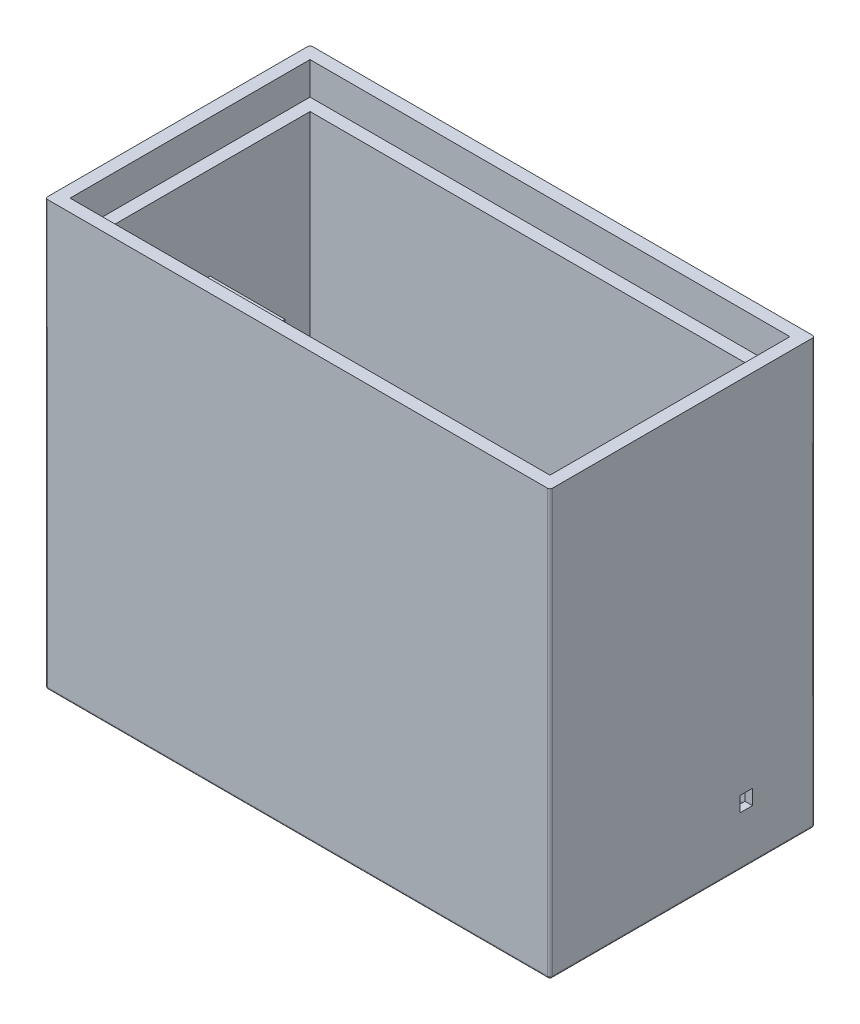
from build123d import *

# Parameters (mm, degrees)
SKETCH1_2_W             = 20.2
SKETCH1_2_H             = 10.6
SKETCH1_2_W_2           = 18.2
SKETCH1_2_H_2           = 8.6
BOSS_EXTRUDE1_DEPTH     = 17
SKETCH3_W               = 8.6
SKETCH3_H               = 1
BOSS_EXTRUDE2_DEPTH     = 19.2
SKETCH4_W               = 19.2
SKETCH4_H               = 9.6
CUT_EXTRUDE1_DEPTH      = 1.3
CUT_EXTRUDE2_REACH      = 22.472
SKETCH6_R               = 1.5
SKETCH8_W               = 0.4
SKETCH8_H               = 11
BOSS_EXTRUDE3_DEPTH     = 3
CUT_EXTRUDE3_DEPTH      = 27.186446876
CUT_EXTRUDE3_DEPTH_BACK = 27.186446876
SKETCH11_W              = 0.5
SKETCH11_H              = 0.6
FILLET12_R              = 0.1
FILLET13_R              = 0.1
SKETCH13_W              = 1.7
SKETCH13_H              = 1.6
CUT_EXTRUDE4_DEPTH      = 0.7


with BuildPart() as part:
    # Sketch1<2> → Boss-Extrude1 (new body)
    with BuildSketch(Plane(origin=(0, 0, 0), x_dir=(1, 0, 0), z_dir=(0, 1, 0))):
        Rectangle(SKETCH1_2_W, SKETCH1_2_H)
        Rectangle(SKETCH1_2_W_2, SKETCH1_2_H_2, mode=Mode.SUBTRACT)
    extrude(amount=BOSS_EXTRUDE1_DEPTH)

    # Sketch3 → Boss-Extrude2 (add)
    with BuildSketch(Plane(origin=(-9.1, 0, 0), x_dir=(0, 0, -1), z_dir=(1, 0, 0))):
        with Locations((0, 0.5)):
            Rectangle(SKETCH3_W, SKETCH3_H)
    extrude(amount=BOSS_EXTRUDE2_DEPTH)

    # Sketch4 → Cut-Extrude1 (cut)
    with BuildSketch(Plane(origin=(0, 17, 0), x_dir=(1, 0, 0), z_dir=(0, 1, 0))):
        Rectangle(SKETCH4_W, SKETCH4_H)
    extrude(amount=-CUT_EXTRUDE1_DEPTH, mode=Mode.SUBTRACT)

    # Sketch6 → Cut-Extrude2 (cut, up to next)
    with BuildSketch(Plane.XZ, mode=Mode.PRIVATE) as cut_extrude2_sk1:
        with Locations(Location((0, 2, 0), (0, 0, 270))):
            Circle(SKETCH6_R)
    cut_extrude2_tool1 = extrude(cut_extrude2_sk1.sketch, amount=-CUT_EXTRUDE2_REACH, mode=Mode.PRIVATE) & part.part
    add(cut_extrude2_tool1.solids().sort_by_distance((0, 0, 2))[0], mode=Mode.SUBTRACT)

    # Sketch8 → Boss-Extrude3 (add)
    with BuildSketch(Plane(origin=(-9.1, 0, 0), x_dir=(0, 0, -1), z_dir=(1, 0, 0))):
        with Locations((0.1, 6.5)):
            Rectangle(SKETCH8_W, SKETCH8_H)
    boss_extrude3 = extrude(amount=BOSS_EXTRUDE3_DEPTH)

    # Mirror1: Boss-Extrude3 across plane
    add(boss_extrude3.mirror(Plane(origin=(0, 0, 0), x_dir=(0, 0, 1), z_dir=(1, 0, 0))))

    # Sketch11 → Cut-Extrude3 (cut, two sides: drawn at the far end of the back side and taken through both)
    with BuildSketch(Plane(origin=(-9.1, 0, 0), x_dir=(0, 0, -1), z_dir=(1, 0, 0)).offset(-CUT_EXTRUDE3_DEPTH_BACK)):
        with Locations((2.55, 2.3)):
            Rectangle(SKETCH11_W, SKETCH11_H)
    extrude(amount=CUT_EXTRUDE3_DEPTH + CUT_EXTRUDE3_DEPTH_BACK, mode=Mode.SUBTRACT)

    # Fillet12
    fillet12_edges = [part.edges().sort_by_distance(p)[0] for p in [
        (10.1, 8.5, 5.3),
        (-10.1, 8.5, 5.3),
        (-10.1, 8.5, -5.3),
        (10.1, 8.5, -5.3),
    ]]
    fillet(fillet12_edges, radius=FILLET12_R)

    # Fillet13
    fillet13_edges = [part.edges().sort_by_distance(p)[0] for p in [
        (0, 0, 5.3),
        (0, 0, -5.3),
        (10.1, 0, 0),
        (-10.1, 0, 0),
        (-10.070710678, 0, -5.270710678),
        (10.070710678, 0, -5.270710678),
        (10.070710678, 0, 5.270710678),
        (-10.070710678, 0, 5.270710678),
    ]]
    fillet(fillet13_edges, radius=FILLET13_R)

    # Sketch13 → Cut-Extrude4 (cut)
    with BuildSketch(Plane(origin=(-9.1, 0, 0), x_dir=(0, 0, -1), z_dir=(1, 0, 0))):
        with Locations((2.35, 2.3)):
            Rectangle(SKETCH13_W, SKETCH13_H)
    cut_extrude4 = extrude(amount=-CUT_EXTRUDE4_DEPTH, mode=Mode.SUBTRACT)

    # Mirror2: Cut-Extrude4 across plane
    add(cut_extrude4.mirror(Plane(origin=(0, 0, 0), x_dir=(0, 0, 1), z_dir=(1, 0, 0))), mode=Mode.SUBTRACT)


solid = part.part
